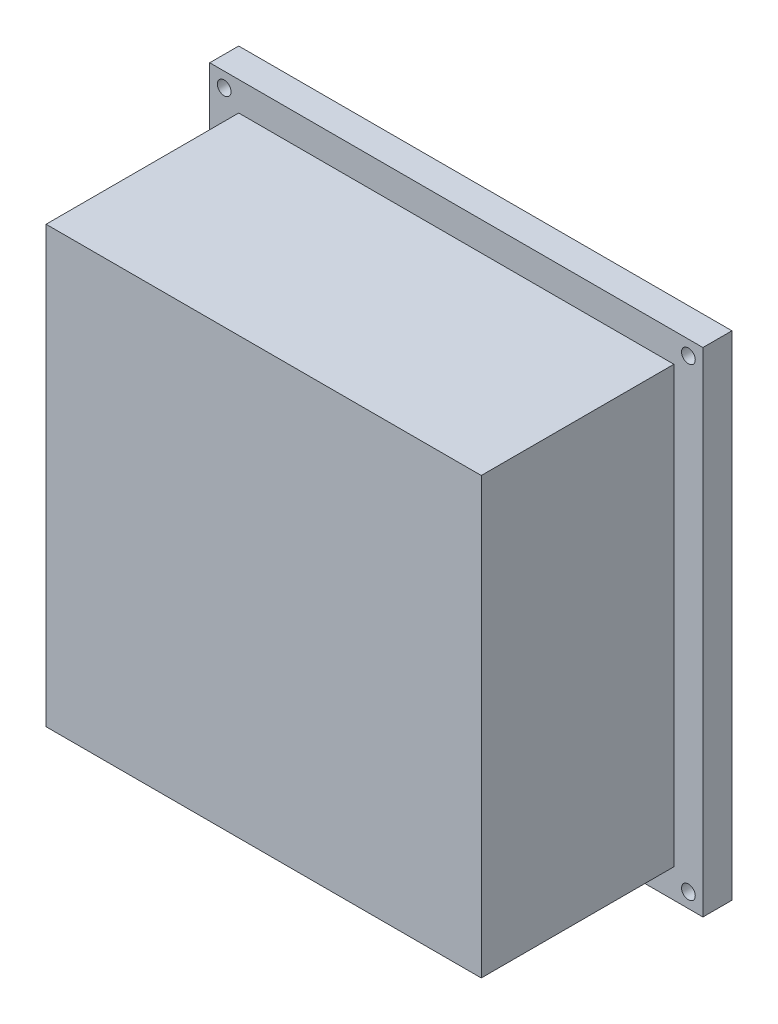
from build123d import *

# Parameters (mm, degrees)
SKETCH6_W           = 95.25
SKETCH6_H           = 95.25
SKETCH6_W_2         = 88.9
SKETCH6_H_2         = 88.9
BOSS_EXTRUDE3_DEPTH = 42.164
SKETCH7_W           = 107.95
SKETCH7_H           = 107.95
SKETCH7_R           = 1.5
SKETCH7_W_2         = 95.25
SKETCH7_H_2         = 95.25
BOSS_EXTRUDE4_DEPTH = 6.35
SKETCH8_W           = 95.25
SKETCH8_H           = 95.25
BOSS_EXTRUDE5_DEPTH = 6.35


with BuildPart() as part:
    # Sketch6 → Boss-Extrude3 (new body)
    with BuildSketch(Plane.XY):
        Rectangle(SKETCH6_W, SKETCH6_H)
        Rectangle(SKETCH6_W_2, SKETCH6_H_2, mode=Mode.SUBTRACT)
    extrude(amount=BOSS_EXTRUDE3_DEPTH)

    # Sketch7 → Boss-Extrude4 (add)
    with BuildSketch(Plane.XY):
        Rectangle(SKETCH7_W, SKETCH7_H)
        with Locations((-50.8, 50.8)):
            Circle(SKETCH7_R, mode=Mode.SUBTRACT)
        with Locations((50.8, 50.8)):
            Circle(SKETCH7_R, mode=Mode.SUBTRACT)
        with Locations((-50.8, -50.8)):
            Circle(SKETCH7_R, mode=Mode.SUBTRACT)
        with Locations((50.8, -50.8)):
            Circle(SKETCH7_R, mode=Mode.SUBTRACT)
        Rectangle(SKETCH7_W_2, SKETCH7_H_2, mode=Mode.SUBTRACT)
    extrude(amount=BOSS_EXTRUDE4_DEPTH)

    # Sketch8 → Boss-Extrude5 (add)
    with BuildSketch(Plane.XY.offset(42.164)):
        Rectangle(SKETCH8_W, SKETCH8_H)
    extrude(amount=BOSS_EXTRUDE5_DEPTH)


solid = part.part
